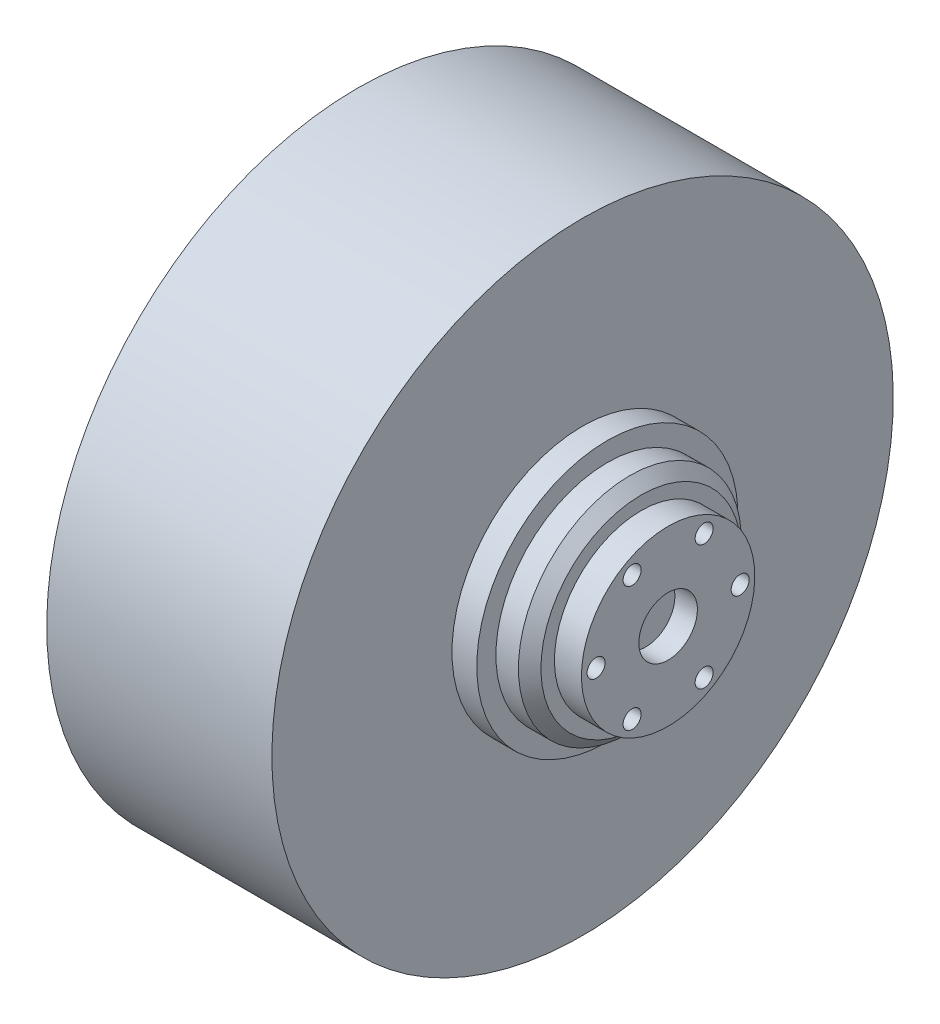
from build123d import *

# Parameters (mm, degrees)
SZKIC4_R                   = 4
WYTNIJ_WYCI_GNI_CIE1_DEPTH = 10
SZKIC5_R                   = 13
WYTNIJ_WYCI_GNI_CIE2_DEPTH = 10


with BuildPart() as part:
    # Szkic1 → Obrót1 (revolve)
    with BuildSketch(Plane.XY, mode=Mode.PRIVATE) as obr_t1_sk:
        Polygon((-90, -36.5), (-70, -36.5), (-70, -47), (-48, -47), (-48, -138), (52, -138), (52, -58), (63, -58), (63, -49.5), (73, -49.5), (78, -44.5), (78, -38.5), (90, -38.5), (90, 0), (-90, 0), align=None)
    revolve(obr_t1_sk.sketch.rotate(Axis((90, 0, 0), (-1, 0, 0)), 180), axis=Axis((90, 0, 0), (-1, 0, 0)))

    # Szkic4 → Wytnij-wyciągnięcie1 (cut)
    with BuildSketch(Plane(origin=(90, 0, 0), x_dir=(0, 0, -1), z_dir=(1, 0, 0))):
        with Locations(Location((16, 27.712812921, 0), (0, 0, 90))):
            Circle(SZKIC4_R)
        with Locations(Location((32, 0, 0), (0, 0, 90))):
            Circle(SZKIC4_R)
        with Locations(Location((16, -27.712812921, 0), (0, 0, 90))):
            Circle(SZKIC4_R)
        with Locations(Location((-16, -27.712812921, 0), (0, 0, 90))):
            Circle(SZKIC4_R)
        with Locations(Location((-32, 0, 0), (0, 0, 90))):
            Circle(SZKIC4_R)
        with Locations(Location((-16, 27.712812921, 0), (0, 0, 90))):
            Circle(SZKIC4_R)
    extrude(amount=-WYTNIJ_WYCI_GNI_CIE1_DEPTH, mode=Mode.SUBTRACT)

    # Szkic5 → Wytnij-wyciągnięcie2 (cut)
    with BuildSketch(Plane(origin=(90, 0, 0), x_dir=(0, 0, -1), z_dir=(1, 0, 0))):
        with Locations(Location((0, 0, 0), (0, 0, 90))):
            Circle(SZKIC5_R)
    extrude(amount=-WYTNIJ_WYCI_GNI_CIE2_DEPTH, mode=Mode.SUBTRACT)


solid = part.part
